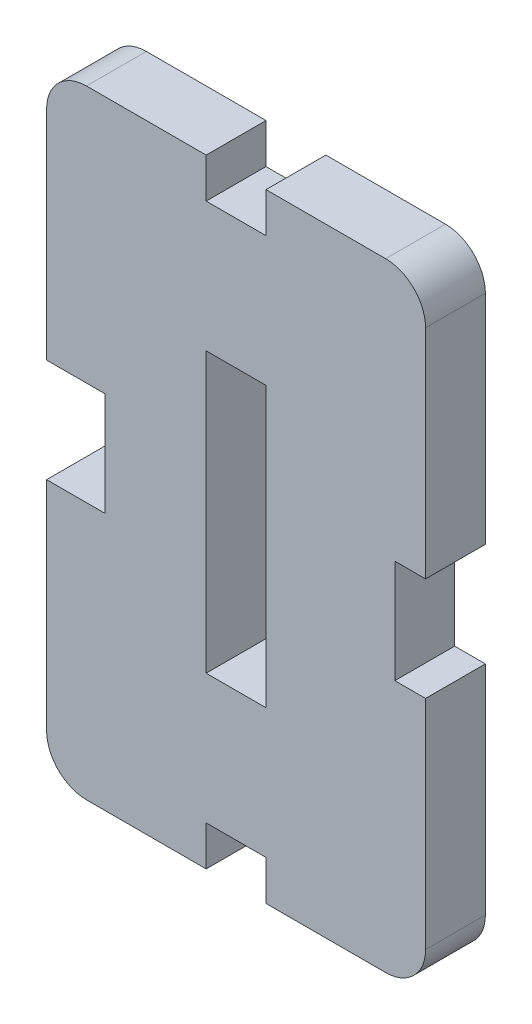
from build123d import *

# Parameters (mm, degrees)
SKETCH1_W          = 3
SKETCH1_H          = 14
BASE_EXTRUDE_DEPTH = 3


with BuildPart() as part:
    # Sketch1 → Base-Extrude (new body)
    with BuildSketch(Plane.XY):
        with BuildLine():
            Line((-1033.116910611, 53.997744838), (-1033.116910611, 43.093073912))
            Line((-1033.116910611, 43.093073912), (-1034.65769353, 43.093073912))
            Line((-1034.65769353, 43.093073912), (-1034.65769353, 37.902415763))
            Line((-1034.65769353, 37.902415763), (-1033.116910611, 37.902415763))
            Line((-1033.116910611, 37.902415763), (-1033.116910611, 26.997744838))
            ThreePointArc((-1033.116910611, 26.997744838), (-1033.702697049, 25.583531275), (-1035.116910611, 24.997744838))
            Line((-1035.116910611, 24.997744838), (-1041.116910611, 24.997744838))
            Line((-1041.116910611, 24.997744838), (-1041.116910611, 26.997744838))
            Line((-1041.116910611, 26.997744838), (-1042.616910611, 26.997744838))
            Line((-1042.616910611, 26.997744838), (-1044.116910611, 26.997744838))
            Line((-1044.116910611, 26.997744838), (-1044.116910611, 24.997744838))
            Line((-1044.116910611, 24.997744838), (-1050.116910611, 24.997744838))
            ThreePointArc((-1050.116910611, 24.997744838), (-1051.531124173, 25.583531275), (-1052.116910611, 26.997744838))
            Line((-1052.116910611, 26.997744838), (-1052.116910611, 37.902415763))
            Line((-1052.116910611, 37.902415763), (-1049.190418334, 37.902415763))
            Line((-1049.190418334, 37.902415763), (-1049.190418334, 43.093073912))
            Line((-1049.190418334, 43.093073912), (-1052.116910611, 43.093073912))
            Line((-1052.116910611, 43.093073912), (-1052.116910611, 53.997744838))
            ThreePointArc((-1052.116910611, 53.997744838), (-1051.531124173, 55.4119584), (-1050.116910611, 55.997744838))
            Line((-1050.116910611, 55.997744838), (-1044.116910611, 55.997744838))
            Line((-1044.116910611, 55.997744838), (-1044.116910611, 53.997744838))
            Line((-1044.116910611, 53.997744838), (-1042.616910611, 53.997744838))
            Line((-1042.616910611, 53.997744838), (-1041.116910611, 53.997744838))
            Line((-1041.116910611, 53.997744838), (-1041.116910611, 55.997744838))
            Line((-1041.116910611, 55.997744838), (-1035.116910611, 55.997744838))
            ThreePointArc((-1035.116910611, 55.997744838), (-1033.702697049, 55.4119584), (-1033.116910611, 53.997744838))
        make_face()
        with Locations((-1042.616910611, 40.497744838)):
            Rectangle(SKETCH1_W, SKETCH1_H, mode=Mode.SUBTRACT)
    extrude(amount=BASE_EXTRUDE_DEPTH)


solid = part.part
